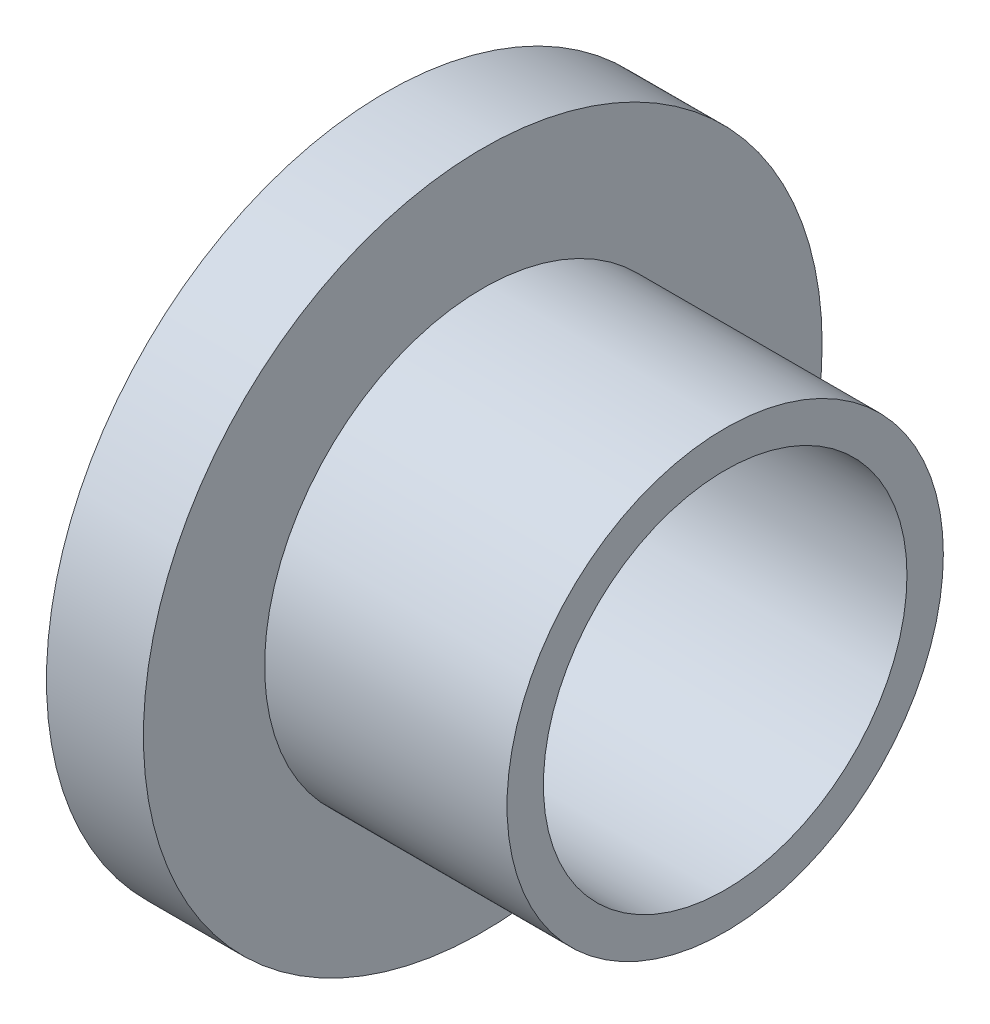
from build123d import *

# Parameters (mm, degrees)
SKETCH_1_R          = 70
EXTRUDE_1_DEPTH     = 70
SKETCH_2_R          = 37.5
CUT_EXTRUDE_1_DEPTH = 122.24355653
SKETCH_3_OUTSIDE_W  = 184
SKETCH_3_OUTSIDE_H  = 184
SKETCH_3_OUTSIDE_R  = 45
CUT_EXTRUDE_2_DEPTH = 50


with BuildPart() as part:
    # 草图1 → 凸台-拉伸1 (new body)
    with BuildSketch(Plane(origin=(0, 0, 0), x_dir=(0, 0, -1), z_dir=(1, 0, 0))):
        Circle(SKETCH_1_R)
    extrude(amount=EXTRUDE_1_DEPTH)

    # 草图2 → 切除-拉伸1 (cut, through all)
    with BuildSketch(Plane(origin=(70, 0, 0), x_dir=(0, 0, -1), z_dir=(1, 0, 0))):
        Circle(SKETCH_2_R)
    extrude(amount=-CUT_EXTRUDE_1_DEPTH, mode=Mode.SUBTRACT)

    # 草图3 outside → 切除-拉伸2 (cut)
    with BuildSketch(Plane(origin=(70, 0, 0), x_dir=(0, 0, -1), z_dir=(1, 0, 0))):
        Rectangle(SKETCH_3_OUTSIDE_W, SKETCH_3_OUTSIDE_H)
        Circle(SKETCH_3_OUTSIDE_R, mode=Mode.SUBTRACT)
    extrude(amount=-CUT_EXTRUDE_2_DEPTH, mode=Mode.SUBTRACT)


solid = part.part
